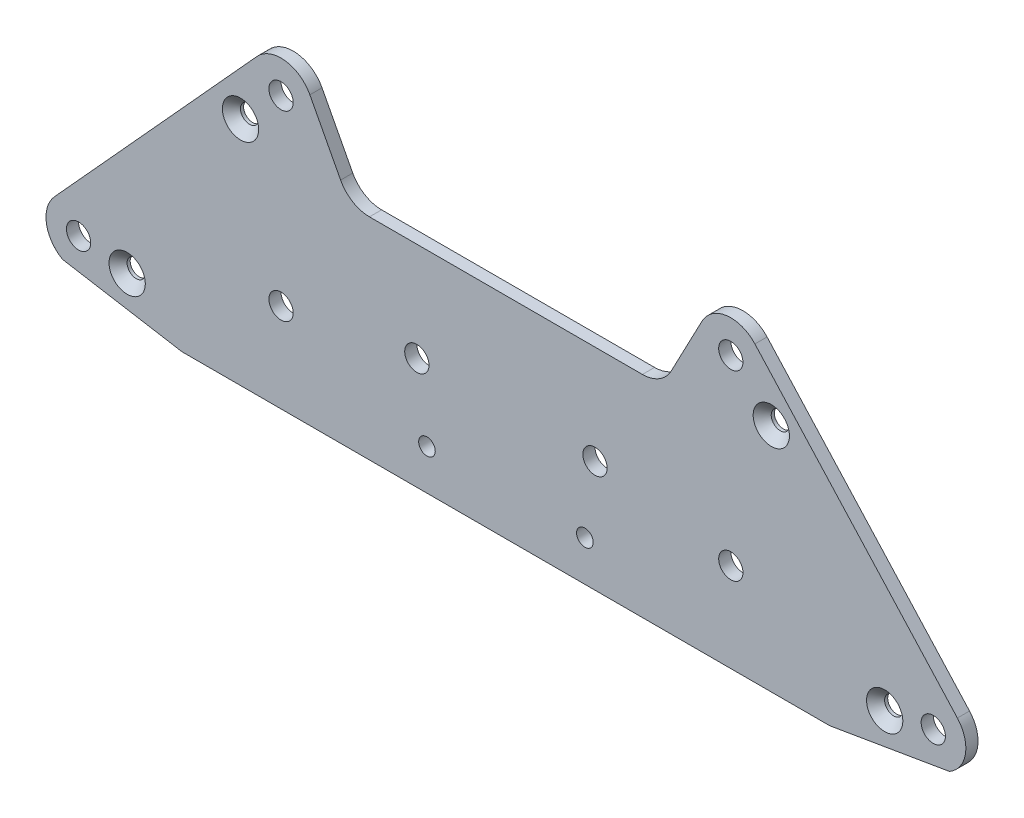
from build123d import *

# Parameters (mm, degrees)
PLATE_DEPTH                  = 3
SKETCH4_R                    = 3
PIVOT_HOLES_ARM_DEPTH        = 130.94157389
SKETCH5_R                    = 2.05
CHASSIS_HOLES_DEPTH          = 130.94157389
CSK_FOR_M4_SFHCS1_AT_2_COUNT = 2
CSK_FOR_M4_SFHCS1_AT_2_PITCH = 54.708317466
CSK_FOR_M4_SFHCS1_AT_3_COUNT = 2
CSK_FOR_M4_SFHCS1_AT_3_PITCH = 165.871053731
CSK_FOR_M4_SFHCS1_AT_4_COUNT = 2
CSK_FOR_M4_SFHCS1_AT_4_PITCH = 187.072959568


with BuildPart() as part:
    # Sketch2 → Plate (new body)
    with BuildSketch(Plane.XY):
        with BuildLine():
            Line((-80, -12), (80, -12))
            Line((80, -12), (109.503808991, -7))
            ThreePointArc((109.503808991, -7), (113.481492527, -1.271406135), (111.490110497, 5.412391557))
            Line((111.490110497, 5.412391557), (61.490110497, 60.412391557))
            ThreePointArc((61.490110497, 60.412391557), (54.517770463, 62.981349031), (48.414233747, 58.743435912))
            Line((48.414233747, 58.743435912), (40.824196955, 44.302662586))
            ThreePointArc((40.824196955, 44.302662586), (37.862458518, 41.159163218), (33.701950918, 40))
            Line((33.701950918, 40), (-33.701950918, 40))
            ThreePointArc((-33.701950918, 40), (-37.862458518, 41.159163218), (-40.824196955, 44.302662586))
            Line((-40.824196955, 44.302662586), (-48.414233747, 58.743435912))
            ThreePointArc((-48.414233747, 58.743435912), (-54.517770463, 62.981349031), (-61.490110497, 60.412391557))
            Line((-61.490110497, 60.412391557), (-111.490110497, 5.412391557))
            ThreePointArc((-111.490110497, 5.412391557), (-113.481492527, -1.271406135), (-109.503808991, -7))
            Line((-109.503808991, -7), (-80, -12))
        make_face()
    extrude(amount=PLATE_DEPTH)

    # Sketch4 → Pivot holes (arm) (cut, through all)
    with BuildSketch(Plane.XY):
        with Locations((105.536479784, 0)):
            Circle(SKETCH4_R)
        with Locations((55.536479784, 10)):
            Circle(SKETCH4_R)
        with Locations((55.536479784, 55)):
            Circle(SKETCH4_R)
        with Locations((-105.536479784, 0)):
            Circle(SKETCH4_R)
        with Locations((-55.536479784, 10)):
            Circle(SKETCH4_R)
        with Locations((-55.536479784, 55)):
            Circle(SKETCH4_R)
        with Locations((-21.998408138, 15.585494631)):
            Circle(SKETCH4_R)
        with Locations((21.998408138, 15.585494631)):
            Circle(SKETCH4_R)
    extrude(amount=PIVOT_HOLES_ARM_DEPTH, mode=Mode.SUBTRACT)

    # Sketch5 → Chassis holes (cut, through all)
    with BuildSketch(Plane.XY.offset(3)):
        with Locations((-19.5, -2)):
            Circle(SKETCH5_R)
        with Locations((19.5, -2)):
            Circle(SKETCH5_R)
    extrude(amount=-CHASSIS_HOLES_DEPTH, mode=Mode.SUBTRACT)

    # Sketch7 → CSK for M4 SFHCS1 (revolve, cut)
    with BuildSketch(Plane(origin=(93.536479784, -2, 3), x_dir=(0, -1, 0), z_dir=(1, 0, 0))):
        Polygon((0, 0), (0, 3), (2.25, 3), (2.25, 2.23), (4.48, 0), align=None)
    csk_for_m4_sfhcs1 = revolve(axis=Axis((93.536479784, -2, 9.35), (0, 0, -1)), mode=Mode.SUBTRACT)

    # CSK for M4 SFHCS1 at 2: CSK for M4 SFHCS1 ×2
    with Locations(*[Vector(-0.5118051750945781, 0.859101543908756, 0) * (i * CSK_FOR_M4_SFHCS1_AT_2_PITCH) for i in range(1, CSK_FOR_M4_SFHCS1_AT_2_COUNT)]):
        add(csk_for_m4_sfhcs1, mode=Mode.SUBTRACT)

    # CSK for M4 SFHCS1 at 3: CSK for M4 SFHCS1 ×2
    with Locations(*[Vector(-0.9590157896162528, 0.2833526341270103, 0) * (i * CSK_FOR_M4_SFHCS1_AT_3_PITCH) for i in range(1, CSK_FOR_M4_SFHCS1_AT_3_COUNT)]):
        add(csk_for_m4_sfhcs1, mode=Mode.SUBTRACT)

    # CSK for M4 SFHCS1 at 4: CSK for M4 SFHCS1 ×2
    with Locations(*[(-i * CSK_FOR_M4_SFHCS1_AT_4_PITCH, 0, 0) for i in range(1, CSK_FOR_M4_SFHCS1_AT_4_COUNT)]):
        add(csk_for_m4_sfhcs1, mode=Mode.SUBTRACT)


solid = part.part
